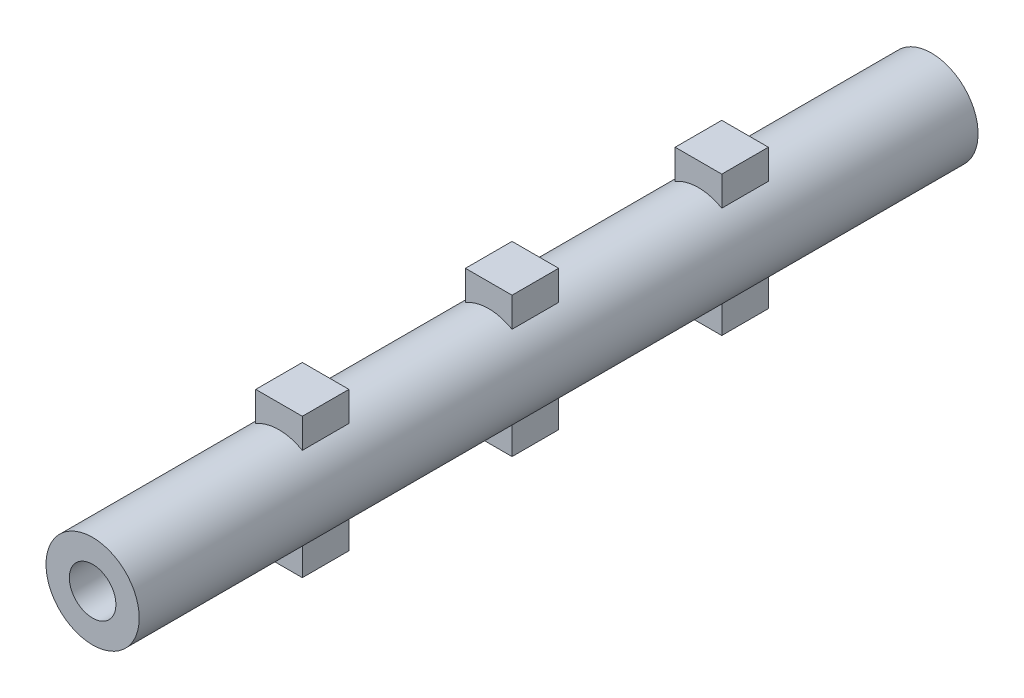
from build123d import *

# Parameters (mm, degrees)
SKETCH1_R             = 5
BOSS_EXTRUDE1_DEPTH   = 25
SKETCH2_W             = 5
SKETCH2_H             = 15
BOSS_EXTRUDE2_DEPTH   = 5
SKETCH3_W             = 5
SKETCH3_H             = 15
BOSS_EXTRUDE3_DEPTH   = 2.5
SKETCH5_W             = 5
SKETCH5_H             = 15
BOSS_EXTRUDE5_DEPTH   = 2.5
BOSS_EXTRUDE6_START   = 25
SKETCH6_R             = 5
BOSS_EXTRUDE6_DEPTH   = 25
SKETCH7_W             = 5
SKETCH7_H             = 15
BOSS_EXTRUDE7_DEPTH   = 5
F_5_0MM_DOWEL_HOLE1_D = 5
BOSS_EXTRUDE8_START   = 20
SKETCH14_R            = 5
BOSS_EXTRUDE8_DEPTH   = 20
SKETCH15_R            = 5
BOSS_EXTRUDE9_DEPTH   = 20
F_5_0MM_DOWEL_HOLE2_D = 5


with BuildPart() as part:
    # Sketch1 → Boss-Extrude1 (new body)
    with BuildSketch(Plane.XY):
        with Locations(Location((0, 0, 0), (0, 0, 180))):
            Circle(SKETCH1_R)
    extrude(amount=BOSS_EXTRUDE1_DEPTH)

    # Sketch2 → Boss-Extrude2 (add)
    with BuildSketch(Plane.XY.offset(25)):
        Rectangle(SKETCH2_W, SKETCH2_H)
    extrude(amount=-BOSS_EXTRUDE2_DEPTH)

    # Sketch3 → Boss-Extrude3 (add)
    with BuildSketch(Plane(origin=(0, 0, 0), x_dir=(-1, 0, 0), z_dir=(0, 0, -1))):
        Rectangle(SKETCH3_W, SKETCH3_H)
    extrude(amount=-BOSS_EXTRUDE3_DEPTH)

    # Sketch5 → Boss-Extrude5 (add)
    with BuildSketch(Plane(origin=(0, 0, 0), x_dir=(-1, 0, 0), z_dir=(0, 0, -1))):
        Rectangle(SKETCH5_W, SKETCH5_H)
    extrude(amount=BOSS_EXTRUDE5_DEPTH)

    # Sketch6 → Boss-Extrude6 (add)
    with BuildSketch(Plane(origin=(0, 0, 0), x_dir=(-1, 0, 0), z_dir=(0, 0, -1)).offset(BOSS_EXTRUDE6_START)):
        Circle(SKETCH6_R)
    extrude(amount=-BOSS_EXTRUDE6_DEPTH)

    # Sketch7 → Boss-Extrude7 (add)
    with BuildSketch(Plane(origin=(0, 0, -25), x_dir=(-1, 0, 0), z_dir=(0, 0, -1))):
        Rectangle(SKETCH7_W, SKETCH7_H)
    extrude(amount=-BOSS_EXTRUDE7_DEPTH)

    # Ø5.0mm Dowel Hole1 (through all)
    with Locations(Plane.XY.offset(25)):
        with Locations((0, 0)):
            Hole(F_5_0MM_DOWEL_HOLE1_D / 2)

    # Sketch14 → Boss-Extrude8 (add)
    with BuildSketch(Plane(origin=(0, 0, -25), x_dir=(-1, 0, 0), z_dir=(0, 0, -1)).offset(BOSS_EXTRUDE8_START)):
        Circle(SKETCH14_R)
    extrude(amount=-BOSS_EXTRUDE8_DEPTH)

    # Sketch15 → Boss-Extrude9 (add)
    with BuildSketch(Plane.XY.offset(25)):
        with Locations(Location((0, 0, 0), (0, 0, 180))):
            Circle(SKETCH15_R)
    extrude(amount=BOSS_EXTRUDE9_DEPTH)

    # Ø5.0mm Dowel Hole2 (through all)
    with Locations(Plane(origin=(0, 0, -45), x_dir=(-1, 0, 0), z_dir=(0, 0, -1))):
        with Locations((0, 0)):
            Hole(F_5_0MM_DOWEL_HOLE2_D / 2)


solid = part.part
